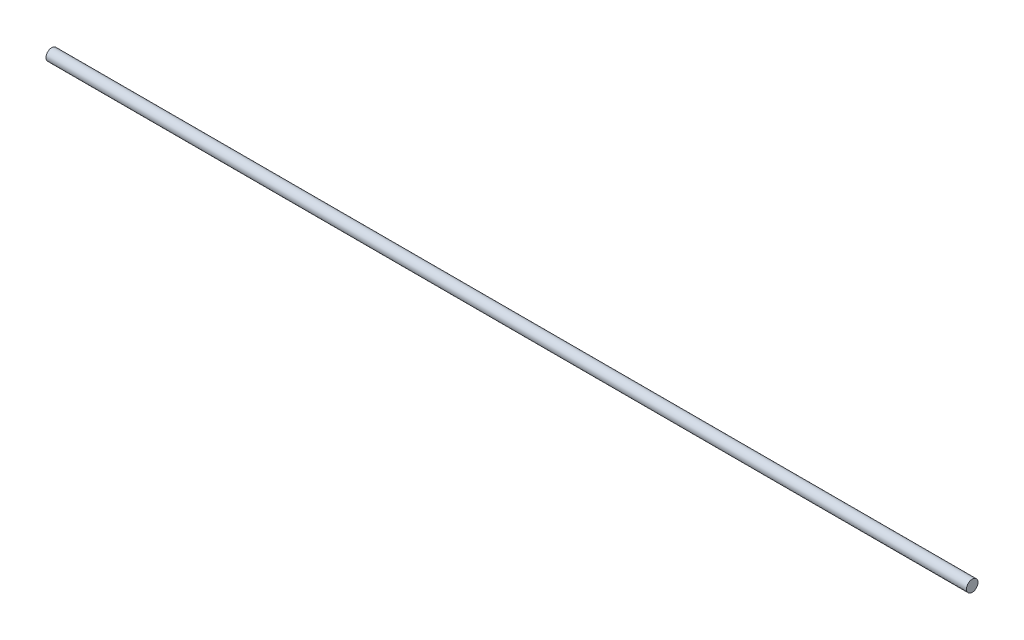
from build123d import *

# Parameters (mm, degrees)
SKETCH1_R           = 5
BOSS_EXTRUDE1_DEPTH = 400


with BuildPart() as part:
    # Sketch1 → Boss-Extrude1 (new, symmetric)
    with BuildSketch(Plane(origin=(0, 0, 0), x_dir=(0, 0, -1), z_dir=(1, 0, 0))):
        Circle(SKETCH1_R)
    extrude(amount=BOSS_EXTRUDE1_DEPTH, both=True)


solid = part.part
